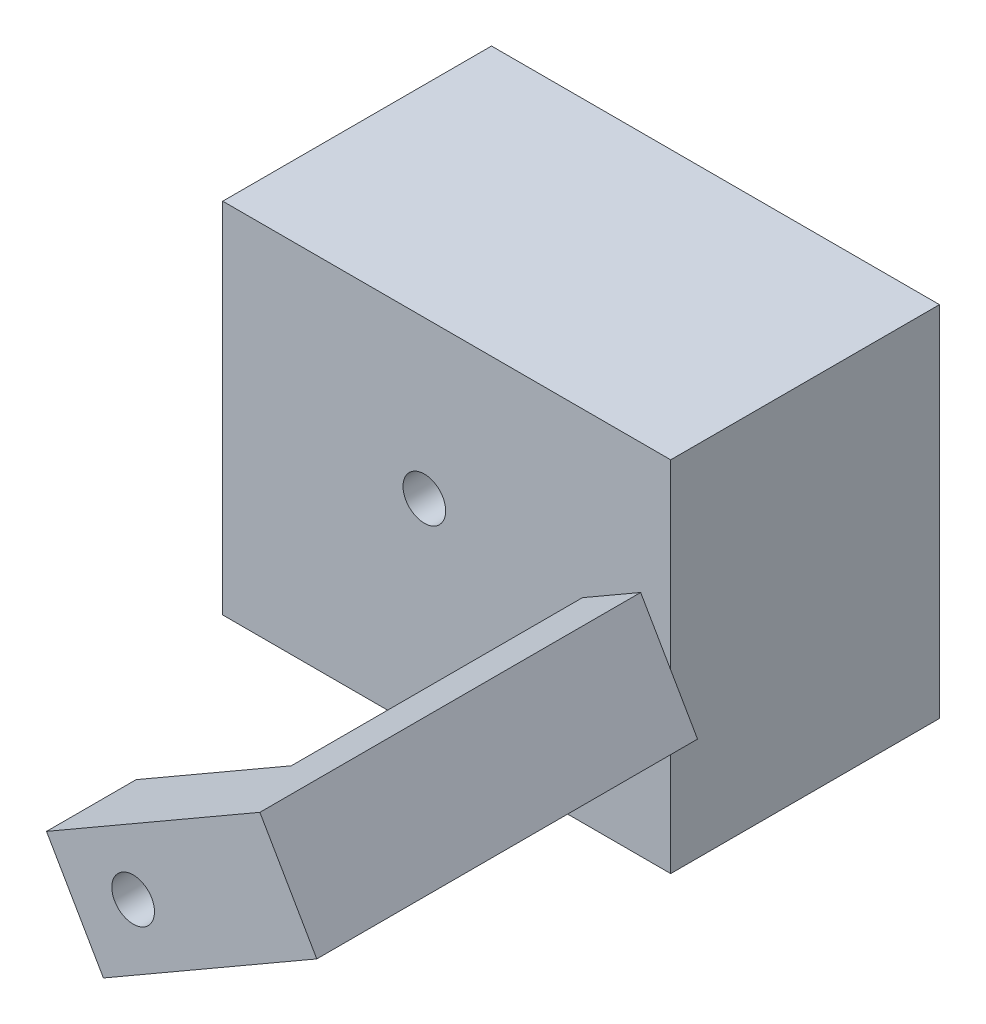
from build123d import *

# Parameters (mm, degrees)
SKETCH1_W               = 100
SKETCH1_H               = 60
BOSS_EXTRUDE1_DEPTH     = 40
BOSS_EXTRUDE2_DEPTH     = 85
CUT_EXTRUDE1_DEPTH      = 110.36175698
CUT_EXTRUDE1_DEPTH_BACK = 110.36175698
SKETCH3_R               = 4.7625
SKETCH5_W               = 20
SKETCH5_H               = 25.4
BOSS_EXTRUDE3_DEPTH     = 40
CUT_EXTRUDE2_DEPTH      = 110.36175698
CUT_EXTRUDE2_DEPTH_BACK = 110.36175698
SKETCH4_R               = 4.7625
CUT_EXTRUDE3_START      = -40
SKETCH6_R               = 4.7625
CUT_EXTRUDE3_DEPTH      = 40


with BuildPart() as part:
    # Sketch1 → Boss-Extrude1 (new, symmetric)
    with BuildSketch(Plane(origin=(0, 0, 0), x_dir=(1, 0, 0), z_dir=(0, 1, 0))):
        Rectangle(SKETCH1_W, SKETCH1_H)
    extrude(amount=BOSS_EXTRUDE1_DEPTH, both=True)

    # Sketch2 → Boss-Extrude2 (add)
    with BuildSketch(Plane.XY.offset(30)):
        Polygon((43.291016151, 10.998522628), (30.300635095, 3.498522628), (43.000635095, -18.498522628), (55.991016151, -10.998522628), align=None)
    extrude(amount=BOSS_EXTRUDE2_DEPTH)

    # Sketch3 → Cut-Extrude1 (cut, two sides: drawn at the far end of the back side and taken through both)
    with BuildSketch(Plane.XY.offset(30).offset(-CUT_EXTRUDE1_DEPTH_BACK)):
        with Locations((15, -20)):
            Circle(SKETCH3_R)
    extrude(amount=CUT_EXTRUDE1_DEPTH + CUT_EXTRUDE1_DEPTH_BACK, mode=Mode.SUBTRACT)

    # Sketch5 → Boss-Extrude3 (add)
    with BuildSketch(Plane(origin=(24.240381057, 13.995190528, 0), x_dir=(0, 0, 1), z_dir=(-0.866025403784436, -0.5000000000000046, 0))):
        with Locations((105, -24.820508076)):
            Rectangle(SKETCH5_W, SKETCH5_H)
    extrude(amount=BOSS_EXTRUDE3_DEPTH)

    # Sketch4 → Cut-Extrude2 (cut, two sides: drawn at the far end of the back side and taken through both)
    with BuildSketch(Plane.XY.offset(30).offset(-CUT_EXTRUDE2_DEPTH_BACK)):
        with Locations((-5, 5)):
            Circle(SKETCH4_R)
    extrude(amount=CUT_EXTRUDE2_DEPTH + CUT_EXTRUDE2_DEPTH_BACK, mode=Mode.SUBTRACT)

    # Sketch6 → Cut-Extrude3 (cut)
    with BuildSketch(Plane(origin=(0, 0, 95), x_dir=(-1, 0, 0), z_dir=(0, 0, -1)).offset(CUT_EXTRUDE3_START)):
        with Locations(Location((-15, -20, 0), (0, 0, 180))):
            Circle(SKETCH6_R)
    extrude(amount=CUT_EXTRUDE3_DEPTH, mode=Mode.SUBTRACT)


solid = part.part
